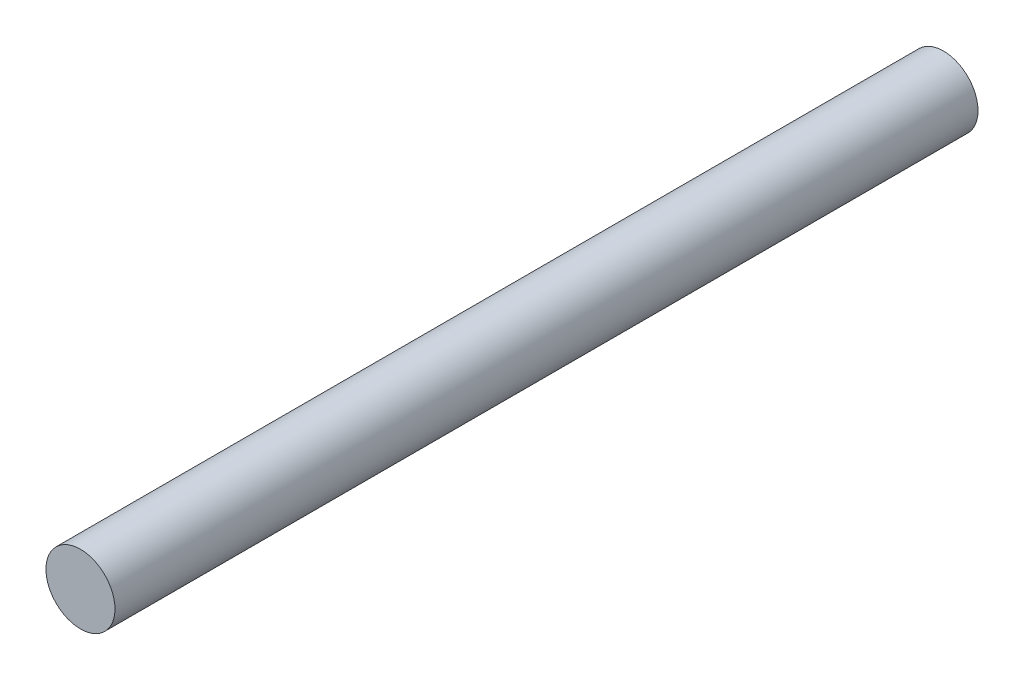
from build123d import *

# Parameters (mm, degrees)
SKETCH1_R           = 1.6
BOSS_EXTRUDE1_DEPTH = 40


with BuildPart() as part:
    # Sketch1 → Boss-Extrude1 (new body)
    with BuildSketch(Plane.XY):
        Circle(SKETCH1_R)
    extrude(amount=BOSS_EXTRUDE1_DEPTH)


solid = part.part
